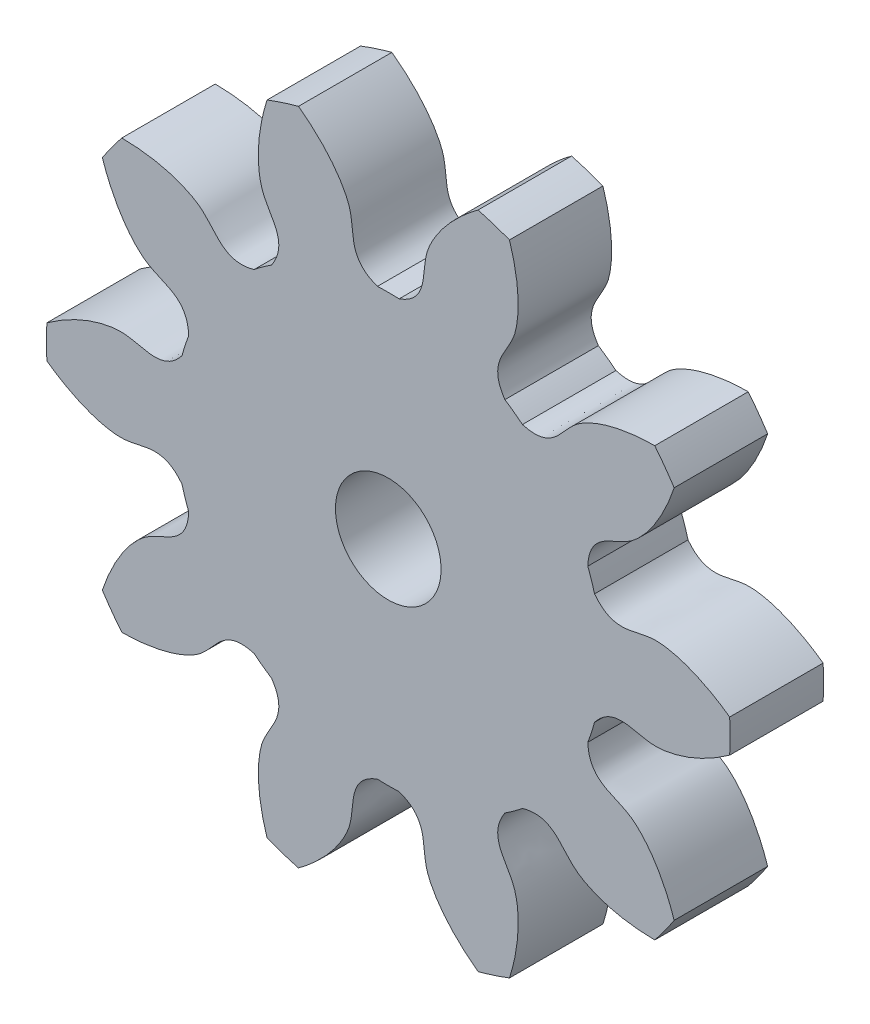
from build123d import *

# Parameters (mm, degrees)
SKETCH_1_R               = 4.2
EXTRUDE_1_DEPTH          = 1.148648649
CUT_EXTRUDE_1_DEPTH      = 7.049743277
PATTERN_CIRCULAR_1_COUNT = 10
SCALE_1_SCALE            = 0.870588235
SKETCH_9_R               = 0.565
CUT_EXTRUDE_2_DEPTH      = 6.178497903


with BuildPart() as part:
    # 草图1 → 凸台-拉伸1 (new body)
    with BuildSketch(Plane.XY):
        Circle(SKETCH_1_R)
    extrude(amount=EXTRUDE_1_DEPTH)

    # 草图2 → 切除-拉伸1 (cut, through all)
    with BuildSketch(Plane.XY):
        with BuildLine():
            ThreePointArc((0.133320786, 2.621612208), (0, 2.625), (-0.133320786, 2.621612208))
            add(Edge.make_bspline(
                [(-0.133320786, 2.621612208), (-0.507801231, 2.75839773), (-0.401689087, 3.059412612), (-0.482063125, 3.307270788), (-0.48615212, 3.31908143), (-0.490931888, 3.33204237), (-0.496448876, 3.346130434), (-0.502750198, 3.361320759), (-0.509881851, 3.377587145), (-0.517889214, 3.394901969), (-0.526816842, 3.413236234), (-0.536708486, 3.432559585), (-0.547607038, 3.45284033), (-0.559554498, 3.474045459), (-0.57259194, 3.496140673), (-0.586759477, 3.519090404), (-0.602096224, 3.542857841), (-0.618640271, 3.567404956), (-0.636428642, 3.592692531), (-0.655497268, 3.618680184), (-0.675880955, 3.645326399), (-0.697613351, 3.672588554), (-0.720726917, 3.700422949), (-0.745252897, 3.728784843), (-0.771221292, 3.757628477), (-0.798660827, 3.786907111), (-0.827598929, 3.816573058), (-0.858061696, 3.846577712), (-0.890073877, 3.876871589), (-0.923658842, 3.907404354), (-0.958838561, 3.938124865), (-0.995633581, 3.968981202), (-1.034063002, 3.999920706), (-1.074144459, 4.030890018), (-1.115894098, 4.061835114), (-1.159326562, 4.092701346), (-1.204454964, 4.123433478), (-1.25129088, 4.153975727), (-1.299844325, 4.184271801), (-1.350123739, 4.214264942), (-1.402135975, 4.243897964), (-1.455886282, 4.273113296), (-1.511378297, 4.301853019), (-1.568614029, 4.330058916), (-1.627593849, 4.357672503), (-1.688316484, 4.384635082), (-1.750779006, 4.410887775), (-1.814976824, 4.436371573), (-1.880903679, 4.461027375), (-1.94855164, 4.484796032), (-2.017911096, 4.507618393), (-2.088970756, 4.529435346), (-2.161717647, 4.550187859), (-2.23613711, 4.569817032), (-2.312212804, 4.588264132), (-2.389926705, 4.605470641), (-2.469259108, 4.621378301), (-2.55018863, 4.635929154), (-2.632692218, 4.64906559), (-2.716745145, 4.660730388), (-2.831717355, 4.674348715), (-2.918884431, 4.682010857), (-2.977510639, 4.68600223)],
                knots=[0, 0, 0, 0, 0.201720712, 0.204696754, 0.208022917, 0.211699204, 0.215725612, 0.220102144, 0.224828797, 0.229905574, 0.235332472, 0.241109493, 0.247236637, 0.253713903, 0.260541292, 0.267718803, 0.275246437, 0.283124193, 0.291352071, 0.299930073, 0.308858196, 0.318136442, 0.327764811, 0.337743302, 0.348071916, 0.358750652, 0.36977951, 0.381158491, 0.392887595, 0.404966821, 0.41739617, 0.430175641, 0.443305234, 0.45678495, 0.470614789, 0.48479475, 0.499324833, 0.514205039, 0.529435368, 0.545015819, 0.560946392, 0.577227088, 0.593857907, 0.610838848, 0.628169911, 0.645851097, 0.663882406, 0.682263837, 0.70099539, 0.720077066, 0.739508864, 0.759290785, 0.779422829, 0.799904995, 0.820737283, 0.841919694, 0.863452227, 0.885334883, 0.907567662, 0.930150562, 0.953083586, 1, 1, 1, 1], degree=3))
            ThreePointArc((-2.977510639, 4.68600223), (0, 5.551953395), (2.977510639, 4.68600223))
            add(Edge.make_bspline(
                [(0.133320786, 2.621612208), (0.507801231, 2.75839773), (0.401689087, 3.059412612), (0.482063125, 3.307270788), (0.48615212, 3.31908143), (0.490931888, 3.33204237), (0.496448876, 3.346130434), (0.502750198, 3.361320759), (0.509881851, 3.377587145), (0.517889214, 3.394901969), (0.526816842, 3.413236234), (0.536708486, 3.432559585), (0.547607038, 3.45284033), (0.559554498, 3.474045459), (0.57259194, 3.496140673), (0.586759477, 3.519090404), (0.602096224, 3.542857841), (0.618640271, 3.567404956), (0.636428642, 3.592692531), (0.655497268, 3.618680184), (0.675880955, 3.645326399), (0.697613351, 3.672588554), (0.720726917, 3.700422949), (0.745252897, 3.728784843), (0.771221292, 3.757628477), (0.798660827, 3.786907111), (0.827598929, 3.816573058), (0.858061696, 3.846577712), (0.890073877, 3.876871589), (0.923658842, 3.907404354), (0.958838561, 3.938124865), (0.995633581, 3.968981202), (1.034063002, 3.999920706), (1.074144459, 4.030890018), (1.115894098, 4.061835114), (1.159326562, 4.092701346), (1.204454964, 4.123433478), (1.25129088, 4.153975727), (1.299844325, 4.184271801), (1.350123739, 4.214264942), (1.402135975, 4.243897964), (1.455886282, 4.273113296), (1.511378297, 4.301853019), (1.568614029, 4.330058916), (1.627593849, 4.357672503), (1.688316484, 4.384635082), (1.750779006, 4.410887775), (1.814976824, 4.436371573), (1.880903679, 4.461027375), (1.94855164, 4.484796032), (2.017911096, 4.507618393), (2.088970756, 4.529435346), (2.161717647, 4.550187859), (2.23613711, 4.569817032), (2.312212804, 4.588264132), (2.389926705, 4.605470641), (2.469259108, 4.621378301), (2.55018863, 4.635929154), (2.632692218, 4.64906559), (2.716745145, 4.660730388), (2.831717355, 4.674348715), (2.918884431, 4.682010857), (2.977510639, 4.68600223)],
                knots=[0, 0, 0, 0, 0.201720712, 0.204696754, 0.208022917, 0.211699204, 0.215725612, 0.220102144, 0.224828797, 0.229905574, 0.235332472, 0.241109493, 0.247236637, 0.253713903, 0.260541292, 0.267718803, 0.275246437, 0.283124193, 0.291352071, 0.299930073, 0.308858196, 0.318136442, 0.327764811, 0.337743302, 0.348071916, 0.358750652, 0.36977951, 0.381158491, 0.392887595, 0.404966821, 0.41739617, 0.430175641, 0.443305234, 0.45678495, 0.470614789, 0.48479475, 0.499324833, 0.514205039, 0.529435368, 0.545015819, 0.560946392, 0.577227088, 0.593857907, 0.610838848, 0.628169911, 0.645851097, 0.663882406, 0.682263837, 0.70099539, 0.720077066, 0.739508864, 0.759290785, 0.779422829, 0.799904995, 0.820737283, 0.841919694, 0.863452227, 0.885334883, 0.907567662, 0.930150562, 0.953083586, 1, 1, 1, 1], degree=3))
        make_face()
    cut_extrude_1 = extrude(amount=CUT_EXTRUDE_1_DEPTH, mode=Mode.SUBTRACT)

    # 阵列(圆周)1: 切除-拉伸1 ×10 about axis
    pattern_circular_1_axis = Axis((0, 0, -1.5), (0, 0, 1))
    for i in range(1, PATTERN_CIRCULAR_1_COUNT):
        add(cut_extrude_1.rotate(pattern_circular_1_axis, i * 360 / PATTERN_CIRCULAR_1_COUNT), mode=Mode.SUBTRACT)


with BuildPart() as part_1:
    # 缩放比例1: scaled about (1.289e-06, -4.44e-07, 0.574327076)
    add(part.part.scale(SCALE_1_SCALE).moved(Location((1.67e-07, -5.7e-08, 0.07432468))))

    # 草图9 → 切除-拉伸2 (cut, through all)
    with BuildSketch(Plane(origin=(0, 0, 0.074324324), x_dir=(-1, 0, 0), z_dir=(0, 0, -1))):
        Circle(SKETCH_9_R)
    extrude(amount=-CUT_EXTRUDE_2_DEPTH, mode=Mode.SUBTRACT)


solid = part_1.part
